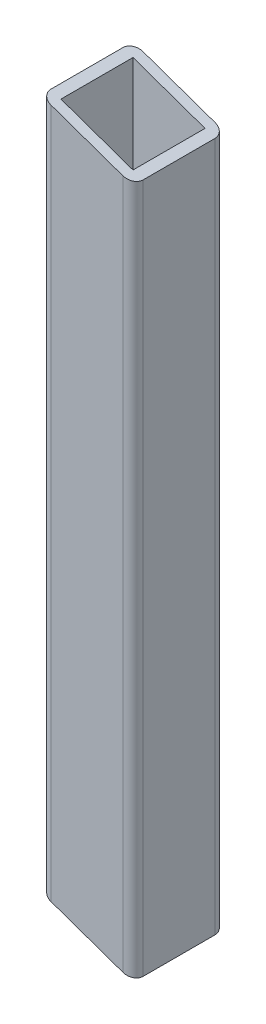
from build123d import *

# Parameters (mm, degrees)
BOSS_EXTRUDE1_DEPTH     = 200.5
SKETCH3_W               = 20
SKETCH3_H               = 20
CUT_EXTRUDE1_DEPTH      = 200.5
CUT_EXTRUDE2_DEPTH      = 204.409562214
CUT_EXTRUDE2_DEPTH_BACK = 204.409562214
CUT_EXTRUDE4_DEPTH      = 204.409562214
CUT_EXTRUDE4_DEPTH_BACK = 204.409562214


with BuildPart() as part:
    # Sketch1 → Boss-Extrude1 (new body)
    with BuildSketch(Plane(origin=(0, 0, 0), x_dir=(1, 0, 0), z_dir=(0, 1, 0))):
        with BuildLine():
            Line((2.8, 0), (22.8, 0))
            ThreePointArc((22.8, 0), (24.779898987, -0.820101013), (25.6, -2.8))
            Line((25.6, -2.8), (25.6, -22.8))
            ThreePointArc((25.6, -22.8), (24.779898987, -24.779898987), (22.8, -25.6))
            Line((22.8, -25.6), (2.8, -25.6))
            ThreePointArc((2.8, -25.6), (0.820101013, -24.779898987), (0, -22.8))
            Line((0, -22.8), (0, -2.8))
            ThreePointArc((0, -2.8), (0.820101013, -0.820101013), (2.8, 0))
        make_face()
    extrude(amount=BOSS_EXTRUDE1_DEPTH)

    # Sketch3 → Cut-Extrude1 (cut)
    with BuildSketch(Plane(origin=(0, 0, 0), x_dir=(-1, 0, 0), z_dir=(0, -1, 0))):
        with Locations((-12.8, -12.8)):
            Rectangle(SKETCH3_W, SKETCH3_H)
    extrude(amount=-CUT_EXTRUDE1_DEPTH, mode=Mode.SUBTRACT)

    # Sketch8 → Cut-Extrude2 (cut, two sides: drawn at the far end of the back side and taken through both)
    with BuildSketch(Plane.XY.offset(22.8).offset(-CUT_EXTRUDE2_DEPTH_BACK)):
        Polygon((416.406994633, -137.395200906), (25.6, 0), (0, 9.000138666), (-390.806994633, 146.395339571), (-665.597396445, -635.218649695), (141.616592822, -919.009190172), align=None)
    extrude(amount=CUT_EXTRUDE2_DEPTH + CUT_EXTRUDE2_DEPTH_BACK, mode=Mode.SUBTRACT)

    # Sketch9 → Cut-Extrude4 (cut, two sides: drawn at the far end of the back side and taken through both)
    with BuildSketch(Plane.XY.offset(22.8).offset(-CUT_EXTRUDE4_DEPTH_BACK)):
        Polygon((-390.749395961, 338.058924984), (0, 200.5), (25.6, 191.487808258), (416.349395961, 53.928883274), (691.467245928, 835.427675195), (-115.631545993, 1119.557716905), align=None)
    extrude(amount=CUT_EXTRUDE4_DEPTH + CUT_EXTRUDE4_DEPTH_BACK, mode=Mode.SUBTRACT)


solid = part.part
